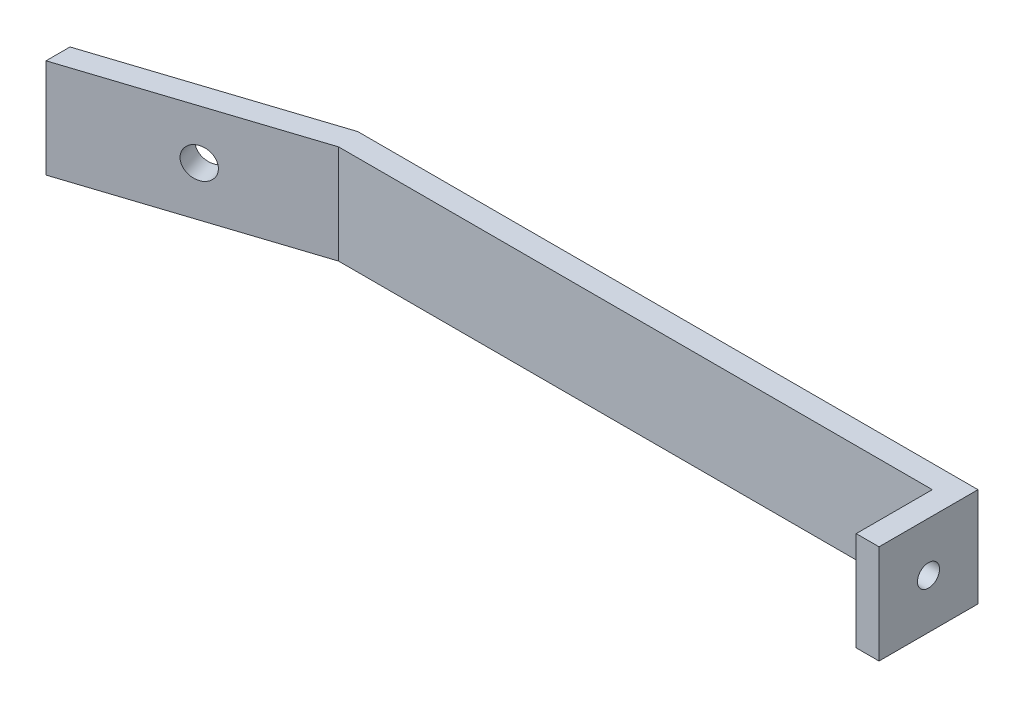
from build123d import *

# Parameters (mm, degrees)
SKETCH1_W           = 110
SKETCH1_H           = 13
BOSS_EXTRUDE1_DEPTH = 50
CUT_EXTRUDE1_DEPTH  = 76.45859792
CUT_EXTRUDE2_DEPTH  = 76.45859792
SKETCH4_R           = 2
CUT_EXTRUDE3_DEPTH  = 62.317648321
SKETCH5_W           = 3
SKETCH5_H           = 13
BOSS_EXTRUDE2_DEPTH = 10
SKETCH6_R           = 1.448838416
CUT_EXTRUDE5_DEPTH  = 12


with BuildPart() as part:
    # Sketch1 → Boss-Extrude1 (new body)
    with BuildSketch(Plane.XY):
        Rectangle(SKETCH1_W, SKETCH1_H)
    extrude(amount=BOSS_EXTRUDE1_DEPTH)

    # Sketch2 → Cut-Extrude1 (cut, through all)
    with BuildSketch(Plane.XZ.offset(6.5)):
        Polygon((-55, 9.270509831), (-26.468304511, 0), (-55, 0), align=None)
    extrude(amount=-CUT_EXTRUDE1_DEPTH, mode=Mode.SUBTRACT)

    # Sketch3 → Cut-Extrude2 (cut, through all)
    with BuildSketch(Plane.XZ.offset(6.5)):
        Polygon((-55, 12.424896504), (-25.99315119, 3), (55, 3), (55, 50), (-55, 50), align=None)
    extrude(amount=-CUT_EXTRUDE2_DEPTH, mode=Mode.SUBTRACT)

    # Sketch4 → Cut-Extrude3 (cut, through all)
    with BuildSketch(Plane(origin=(-2.527498175, 0, -7.778839522), x_dir=(-0.9510565162951533, 0, 0.30901699437494845), z_dir=(-0.30901699437494845, 0, -0.9510565162951533))):
        with Locations((40.172853481, 0)):
            Circle(SKETCH4_R)
    extrude(amount=-CUT_EXTRUDE3_DEPTH, mode=Mode.SUBTRACT)

    # Sketch5 → Boss-Extrude2 (add)
    with BuildSketch(Plane.XY.offset(3)):
        with Locations((53.5, 0)):
            Rectangle(SKETCH5_W, SKETCH5_H)
    extrude(amount=BOSS_EXTRUDE2_DEPTH)

    # Sketch6 → Cut-Extrude5 (cut)
    with BuildSketch(Plane(origin=(55, 0, 0), x_dir=(0, 0, -1), z_dir=(1, 0, 0))):
        with Locations((-6.5, 0)):
            Circle(SKETCH6_R)
    extrude(amount=-CUT_EXTRUDE5_DEPTH, mode=Mode.SUBTRACT)


solid = part.part
